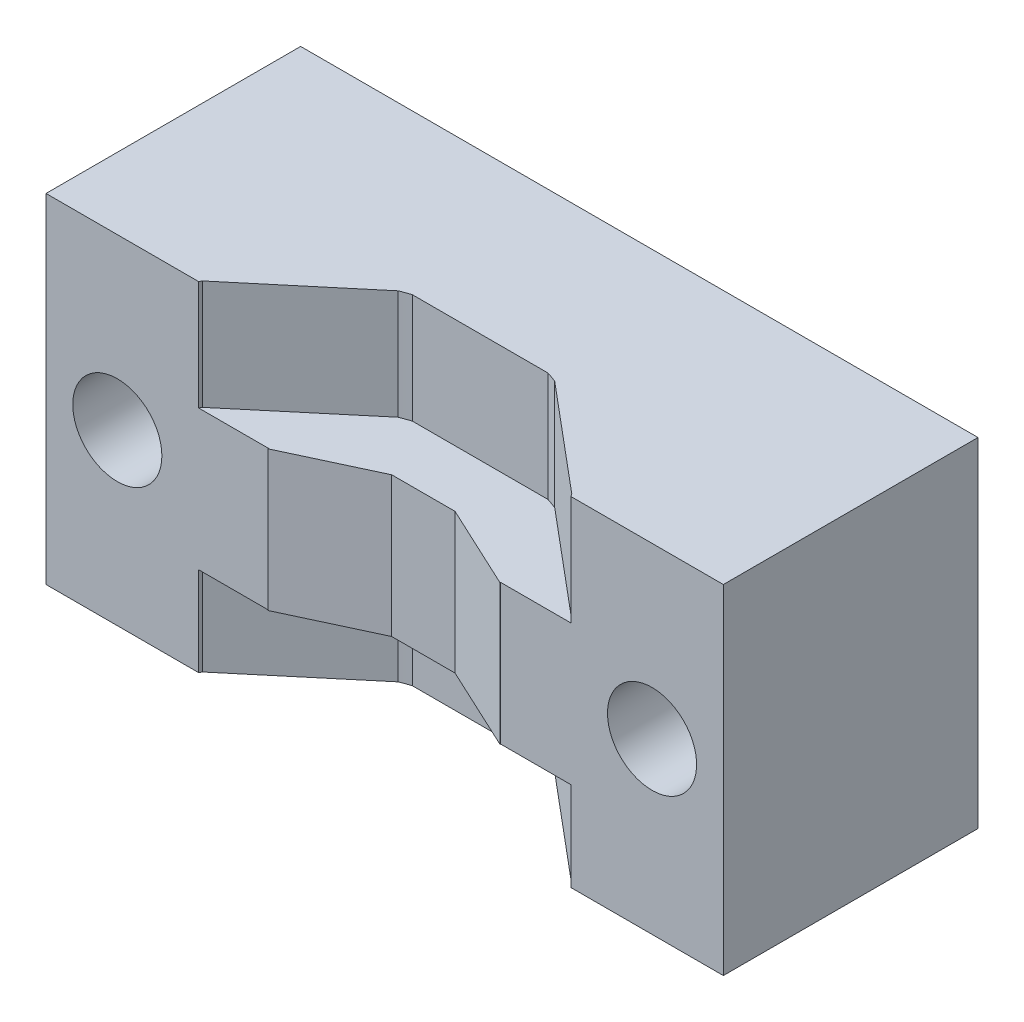
from build123d import *

# Parameters (mm, degrees)
ESBO_O1_W                = 26.6
ESBO_O1_H                = 13.3
RESSALTO_EXTRUS_O1_DEPTH = 10
ESBO_O2_R                = 1.75
CORTE_EXTRUS_O1_DEPTH    = 18.919612776
ESBO_O3_R                = 8.48
CORTE_EXTRUS_O2_DEPTH    = 4.3
ESBO_O3_3_R              = 6.25
CORTE_EXTRUS_O3_DEPTH    = 9.8
CORTE_EXTRUS_O4_START    = -3.5
ESBO_O4_R                = 8.48
CORTE_EXTRUS_O4_DEPTH    = 3.5
RESSALTO_EXTRUS_O2_START = -13.3
RESSALTO_EXTRUS_O2_DEPTH = 13.3
RESSALTO_EXTRUS_O3_DEPTH = 5.5
ESBO_O7_W                = 1.347129382
ESBO_O7_H                = 0.427620669
RESSALTO_EXTRUS_O4_DEPTH = 5.5


with BuildPart() as part:
    # Esboço1 → Ressalto-extrusão1 (new body)
    with BuildSketch(Plane(origin=(7.1e-08, 2.4e-08, -1.999994237), x_dir=(-0.9999999999999994, 0, -3.5493490277080375e-08), z_dir=(3.5493490277080375e-08, 1.1940033902129589e-08, -0.9999999999999994))):
        Rectangle(ESBO_O1_W, ESBO_O1_H)
    extrude(amount=-RESSALTO_EXTRUS_O1_DEPTH)

    # Esboço2 → Corte-extrusão1 (cut, through all)
    with BuildSketch(Plane(origin=(7.1e-08, 2.4e-08, -1.999994237), x_dir=(-0.9999999999999994, 0, -3.549349026814977e-08), z_dir=(3.5493490268149776e-08, 1.1940033893980961e-08, -0.9999999999999994))):
        with Locations((-10.5, 0)):
            Circle(ESBO_O2_R)
        with Locations(Location((10.5, 0, 0), (0, 0, 180))):
            Circle(ESBO_O2_R)
    extrude(amount=-CORTE_EXTRUS_O1_DEPTH, mode=Mode.SUBTRACT)

    # Esboço3 → Corte-extrusão2 (cut)
    with BuildSketch(Plane(origin=(0, 6.65, 7.9e-08), x_dir=(1, 0, 0), z_dir=(0, 1.0, 1.1940033902129584e-08))):
        with Locations((0, -12.300005763)):
            Circle(ESBO_O3_R)
    extrude(amount=-CORTE_EXTRUS_O2_DEPTH, mode=Mode.SUBTRACT)

    # Esboço3<3> → Corte-extrusão3 (cut)
    with BuildSketch(Plane(origin=(0, 6.65, 7.9e-08), x_dir=(1, 0, 0), z_dir=(0, 1.0, 1.1940033902129584e-08))):
        with Locations((0, -12.300005763)):
            Circle(ESBO_O3_3_R)
    extrude(amount=-CORTE_EXTRUS_O3_DEPTH, mode=Mode.SUBTRACT)

    # Esboço4 → Corte-extrusão4 (cut)
    with BuildSketch(Plane(origin=(0, -6.65, -7.9e-08), x_dir=(1, 0, 0), z_dir=(0, -1.0, -1.1940033902129595e-08)).offset(CORTE_EXTRUS_O4_START)):
        with Locations((0, 12.300005763)):
            Circle(ESBO_O4_R)
    extrude(amount=CORTE_EXTRUS_O4_DEPTH, mode=Mode.SUBTRACT)

    # Esboço5 → Ressalto-extrusão2 (add)
    with BuildSketch(Plane(origin=(0, 6.65, 7.9e-08), x_dir=(1, 0, 0), z_dir=(0, 1.0, 1.1940033902129584e-08)).offset(RESSALTO_EXTRUS_O2_START)):
        Polygon((-7.249600207, -7.90072209), (-3.073568805, -4.39661568), (-6.960916747, -4.39661568), align=None)
        Polygon((7.249600207, -7.90072209), (3.073568805, -4.39661568), (6.960916747, -4.39661568), align=None)
        Polygon((-2.666064515, -4.250005763), (2.666064515, -4.250005763), (0, -3.025002882), align=None)
    extrude(amount=RESSALTO_EXTRUS_O2_DEPTH)

    # Esboço6 → Ressalto-extrusão3 (add)
    with BuildSketch(Plane(origin=(0, 2.35, 2.8e-08), x_dir=(1, 0, 0), z_dir=(0, 1.0, 1.1940033914348732e-08))):
        Polygon((-4.561360471, -8.027244285), (-1.243296754, -6.480005763), (1.243296754, -6.480005763), (4.561360471, -8.027244285), (3.582423284, -5.971627344), (0.394906827, -6.062494352), (-0.394906827, -6.062494352), (-3.582423284, -5.971627344), align=None)
    extrude(amount=-RESSALTO_EXTRUS_O3_DEPTH)

    # Esboço7 → Ressalto-extrusão4 (add)
    with BuildSketch(Plane(origin=(0, 2.35, 2.8e-08), x_dir=(1, 0, 0), z_dir=(0, 1.0, 1.1940033894814705e-08))):
        with Locations((0, -6.062494352)):
            Rectangle(ESBO_O7_W, ESBO_O7_H)
    extrude(amount=-RESSALTO_EXTRUS_O4_DEPTH)


solid = part.part
